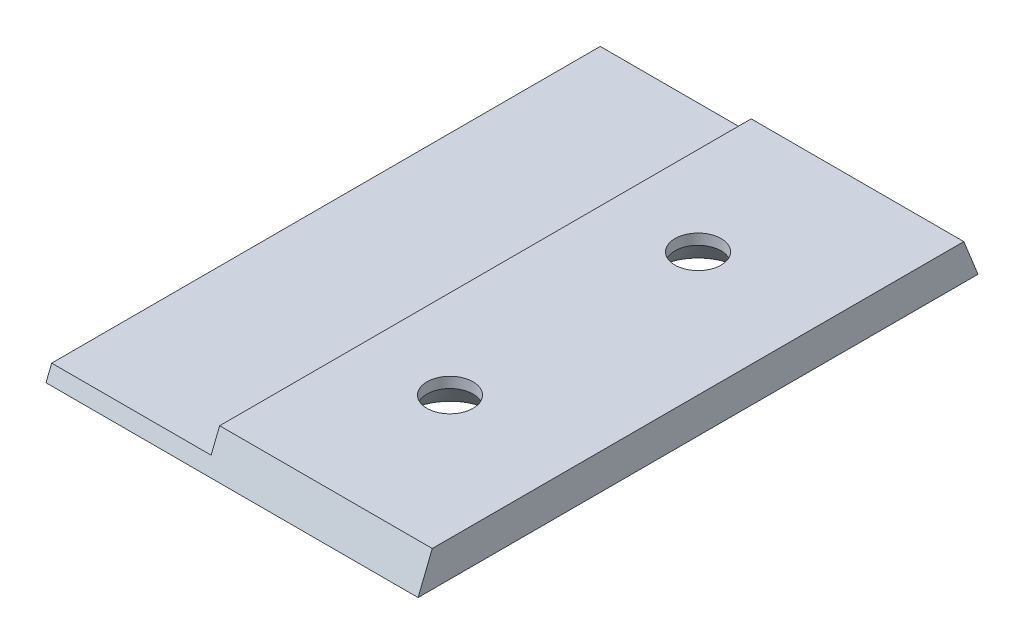
from build123d import *

# Parameters (mm, degrees)
SKETCH_1_W                          = 105
SKETCH_1_H                          = 158
EXTRUDE_1_DEPTH                     = 10
CUT_EXTRUDE_1_REACH                 = 97.38
SKETCH_2_R                          = 6.5
CHAMFER_1_SIZE                      = 5.5
CHAMFER_1_SIZE2                     = 7
PATTERN_LINEAR_1_COUNT              = 2
PATTERN_LINEAR_1_PITCH              = 70
CHAMFER_1_OF_PATTERN_LINEAR_1_SIZE2 = 7
CHAMFER_1_OF_PATTERN_LINEAR_1_SIZE  = 5.5
CUT_EXTRUDE_2_REACH                 = 133.78
SKETCH_4_W                          = 45
SKETCH_4_H                          = 158
CUT_EXTRUDE_3_DEPTH                 = 6


with BuildPart() as part:
    # 草图1 → 凸台-拉伸1 (new body)
    with BuildSketch(Plane(origin=(0, 0, 0), x_dir=(1, 0, 0), z_dir=(0, 1, 0))):
        Rectangle(SKETCH_1_W, SKETCH_1_H)
    extrude(amount=EXTRUDE_1_DEPTH)

    # 草图2 → 切除-拉伸1 (cut, up to next)
    with BuildSketch(Plane.XZ, mode=Mode.PRIVATE) as cut_extrude_1_sk1:
        with Locations(Location((17.5, 35, 0), (0, 0, 270))):
            Circle(SKETCH_2_R)
    cut_extrude_1_tool1 = extrude(cut_extrude_1_sk1.sketch, amount=-CUT_EXTRUDE_1_REACH, mode=Mode.PRIVATE) & part.part
    cut_extrude_1 = cut_extrude_1_tool1.solids().sort_by_distance((17.5, 0, 35))[0]
    add(cut_extrude_1, mode=Mode.SUBTRACT)

    # 倒角1
    chamfer_1_edges = [part.edges().sort_by_distance(p)[0] for p in [
        (17.5, 0, 41.5),
    ]]
    chamfer_1_side = [part.faces().sort_by_distance(p)[0] for p in [
        (-0.141142206, 0, -0.282284412),
    ]]
    chamfer(chamfer_1_edges, length=CHAMFER_1_SIZE, length2=CHAMFER_1_SIZE2, reference=chamfer_1_side[0])

    # 阵列(线性)1: 切除-拉伸1 ×2
    with Locations(*[(0, 0, -i * PATTERN_LINEAR_1_PITCH) for i in range(1, PATTERN_LINEAR_1_COUNT)]):
        add(cut_extrude_1, mode=Mode.SUBTRACT)

    # 倒角1 of 阵列(线性)1
    chamfer_1_of_pattern_linear_1_edges = [part.edges().sort_by_distance(p)[0] for p in [
        (17.5, 0, -28.5),
    ]]
    chamfer(chamfer_1_of_pattern_linear_1_edges, length=CHAMFER_1_OF_PATTERN_LINEAR_1_SIZE, length2=CHAMFER_1_OF_PATTERN_LINEAR_1_SIZE2)

    # 草图3 → 切除-拉伸2 (cut, up to next)
    with BuildSketch(Plane(origin=(52.5, 0, 0), x_dir=(0, 0, -1), z_dir=(1, 0, 0)), mode=Mode.PRIVATE) as cut_extrude_2_sk1:
        Polygon((-79, 10), (-79, 0), (-75.000285359, 10), align=None)
    cut_extrude_2_tool1 = extrude(cut_extrude_2_sk1.sketch, amount=-CUT_EXTRUDE_2_REACH, mode=Mode.PRIVATE) & part.part
    # 草图3 → 切除-拉伸2 (cut, up to next)
    with BuildSketch(Plane(origin=(52.5, 0, 0), x_dir=(0, 0, -1), z_dir=(1, 0, 0)), mode=Mode.PRIVATE) as cut_extrude_2_sk2:
        Polygon((79, 10), (79, 0), (75.000285359, 10), align=None)
    cut_extrude_2_tool2 = extrude(cut_extrude_2_sk2.sketch, amount=-CUT_EXTRUDE_2_REACH, mode=Mode.PRIVATE) & part.part
    add(cut_extrude_2_tool1.solids().sort_by_distance((52.5, 6.666667, 77.666762))[0], mode=Mode.SUBTRACT)
    add(cut_extrude_2_tool2.solids().sort_by_distance((52.5, 6.666667, -77.666762))[0], mode=Mode.SUBTRACT)

    # 草图4 → 切除-拉伸3 (cut)
    with BuildSketch(Plane(origin=(0, 10, 0), x_dir=(1, 0, 0), z_dir=(0, 1, 0))):
        with Locations((-30, 0)):
            Rectangle(SKETCH_4_W, SKETCH_4_H)
    extrude(amount=-CUT_EXTRUDE_3_DEPTH, mode=Mode.SUBTRACT)


solid = part.part
